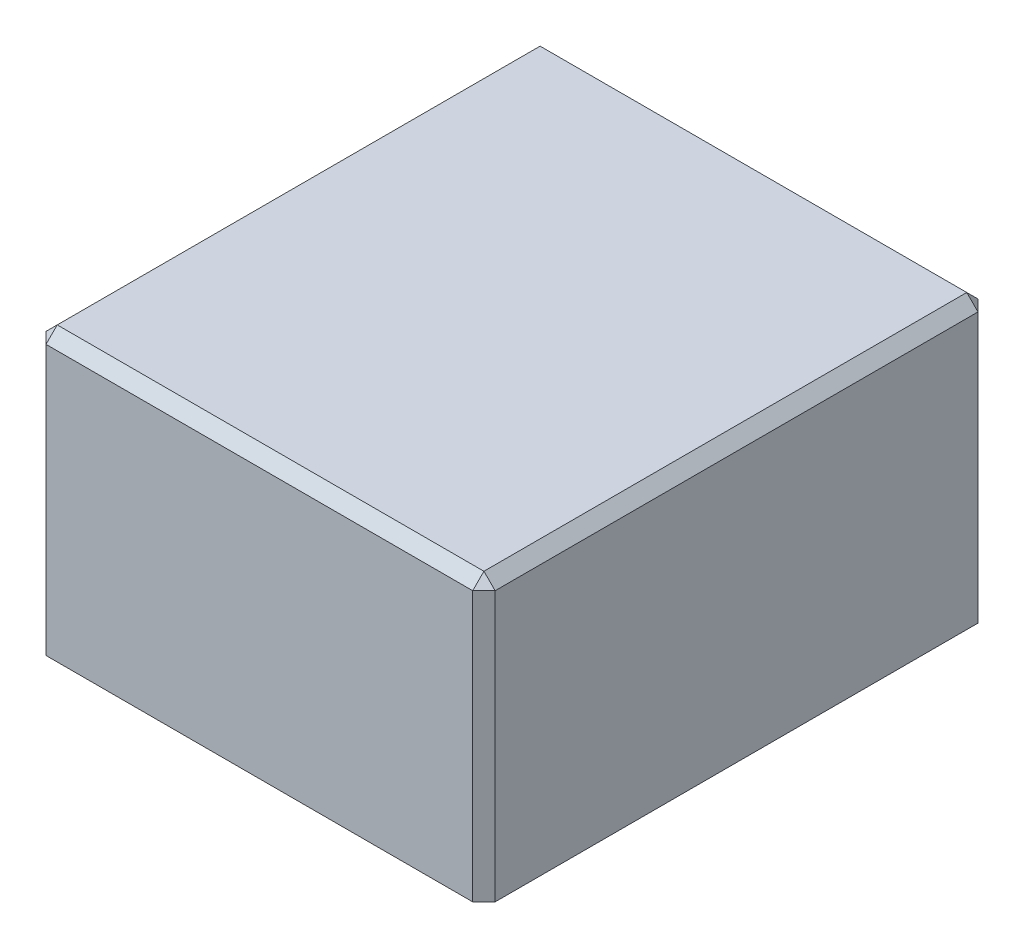
from build123d import *

# Parameters (mm, degrees)
SKETCH1_W           = 4
SKETCH1_H           = 4.5
SKETCH1_W_2         = 3.2
SKETCH1_H_2         = 3.7
BOSS_EXTRUDE1_DEPTH = 0.5
SKETCH2_W           = 4
SKETCH2_H           = 4.5
BOSS_EXTRUDE2_DEPTH = 2
CHAMFER1_SIZE       = 0.1


with BuildPart() as part:
    # Sketch1 → Boss-Extrude1 (new body)
    with BuildSketch(Plane(origin=(0, 0, 0), x_dir=(1, 0, 0), z_dir=(0, 1, 0))):
        Rectangle(SKETCH1_W, SKETCH1_H)
        Rectangle(SKETCH1_W_2, SKETCH1_H_2, mode=Mode.SUBTRACT)
    extrude(amount=BOSS_EXTRUDE1_DEPTH)

    # Sketch2 → Boss-Extrude2 (add)
    with BuildSketch(Plane(origin=(0, 0.5, 0), x_dir=(1, 0, 0), z_dir=(0, 1, 0))):
        Rectangle(SKETCH2_W, SKETCH2_H)
    extrude(amount=BOSS_EXTRUDE2_DEPTH)

    # Chamfer1
    chamfer1_edges = [part.edges().sort_by_distance(p)[0] for p in [
        (0, 2.5, -2.25),
        (-2, 2.5, 0),
        (0, 2.5, 2.25),
        (2, 2.5, 0),
        (-2, 1.25, -2.25),
        (2, 1.25, -2.25),
        (2, 1.25, 2.25),
        (-2, 1.25, 2.25),
    ]]
    chamfer(chamfer1_edges, length=CHAMFER1_SIZE)


solid = part.part
